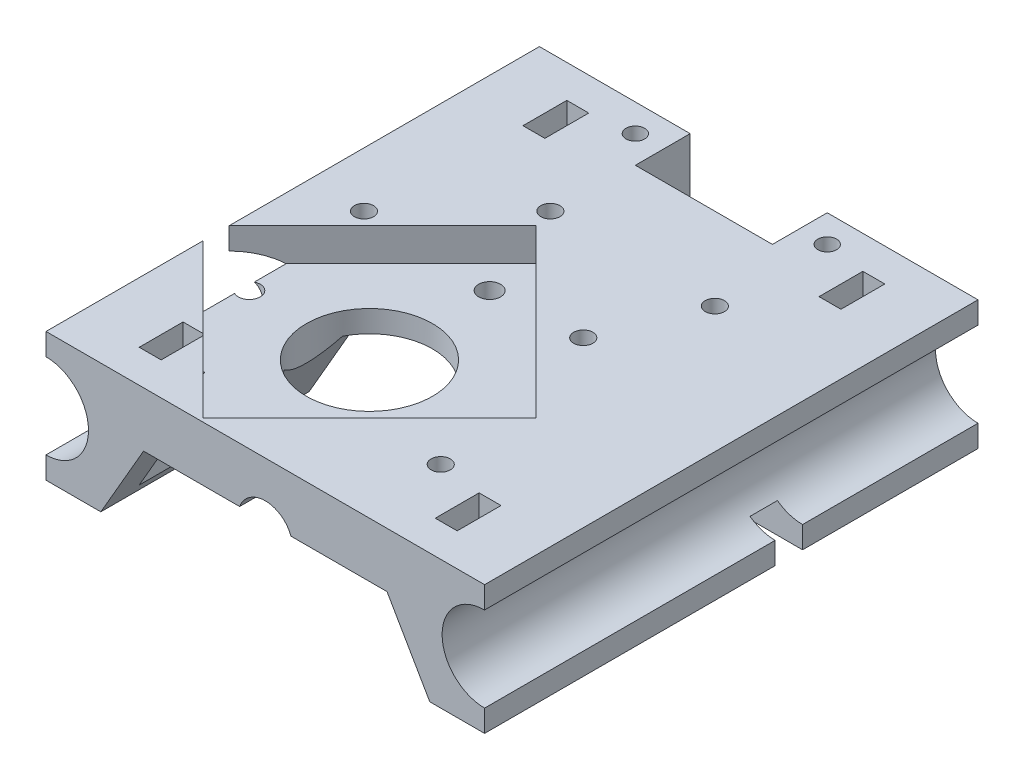
from build123d import *

# Parameters (mm, degrees)
RESSALTO_EXTRUS_O1_DEPTH   = 90
ESBO_O2_R                  = 5
CORTE_EXTRUS_O1_DEPTH      = 6
CORTE_EXTRUS_O2_DEPTH      = 101.031245119
CORTE_EXTRUS_O2_DEPTH_BACK = 101.031245119
ESBO_O3_R                  = 2
ESBO_O3_R_2                = 11.5
ESBO_O3_R_3                = 1.75
ESBO_O3_R_4                = 1.7
ESBO_O3_W                  = 25
ESBO_O3_H                  = 10
CORTE_EXTRUS_O4_START      = 8
ESBO_O4_W                  = 22.305447344
ESBO_O4_H                  = 5
ESBO_O4_W_2                = 48.791448981
CORTE_EXTRUS_O4_DEPTH      = 12
CORTE_EXTRUS_O7_REACH      = 103.253
ESBO_O6_R                  = 8
ESBO_O6_W                  = 20
ESBO_O6_H                  = 20
ESBO_O7_W                  = 4
ESBO_O7_H                  = 8
CORTE_EXTRUS_O8_DEPTH      = 102.253395156
ESBO_O11_R                 = 3.5
ESBO_O11_R_2               = 1.75
RESSALTO_EXTRUS_O3_DEPTH   = 12


with BuildPart() as part:
    # Esboço1 → Ressalto-extrusão1 (new body)
    with BuildSketch(Plane.XY):
        with BuildLine():
            Line((40, 0), (-40, 0))
            Line((-40, 0), (-40, -4))
            ThreePointArc((-40, -4), (-32.25, -11.75), (-40, -19.5))
            Line((-40, -19.5), (-40, -23.5))
            Line((-40, -23.5), (-30, -23.5))
            Line((-30, -23.5), (-22.205771366, -10))
            Line((-22.205771366, -10), (-4.683748499, -10))
            ThreePointArc((-4.683748499, -10), (0, -6.75), (4.683748499, -10))
            Line((4.683748499, -10), (22.205771366, -10))
            Line((22.205771366, -10), (30, -23.5))
            Line((30, -23.5), (40, -23.5))
            Line((40, -23.5), (40, -19.5))
            ThreePointArc((40, -19.5), (32.25, -11.75), (40, -4))
            Line((40, -4), (40, 0))
        make_face()
    extrude(amount=RESSALTO_EXTRUS_O1_DEPTH)

    # Esboço2 → Corte-extrusão1 (cut)
    with BuildSketch(Plane(origin=(0, 0, 0), x_dir=(1, 0, 0), z_dir=(0, 1, 0))):
        Polygon((-42.405591591, -59), (-12, -28.594408409), (18.405591591, -59), (-12, -89.405591591), align=None)
        with Locations(Location((-12, -59, 0), (0, 0, 270))):
            Circle(ESBO_O2_R, mode=Mode.SUBTRACT)
    extrude(amount=-CORTE_EXTRUS_O1_DEPTH, mode=Mode.SUBTRACT)

    # Esboço3 → Corte-extrusão2 (cut, two sides: drawn at the far end of the back side and taken through both)
    with BuildSketch(Plane(origin=(0, -6, 0), x_dir=(1, 0, 0), z_dir=(0, 1, 0)).offset(-CORTE_EXTRUS_O2_DEPTH_BACK)):
        with Locations(Location((-12, -37.079689783, 0), (0, 0, 180))):
            Circle(ESBO_O3_R)
        with Locations(Location((9.920310217, -59, 0), (0, 0, 180))):
            Circle(ESBO_O3_R)
        with Locations(Location((-12, -80.920310217, 0), (0, 0, 180))):
            Circle(ESBO_O3_R)
        with Locations(Location((-33.920310217, -59, 0), (0, 0, 180))):
            Circle(ESBO_O3_R)
        with Locations(Location((-12, -59, 0), (0, 0, 180))):
            Circle(ESBO_O3_R_2)
        with Locations(Location((-30, -42, 0), (0, 0, 180))):
            Circle(ESBO_O3_R_3)
        with Locations(Location((10, -42, 0), (0, 0, 180))):
            Circle(ESBO_O3_R_3)
        with Locations(Location((-17.5, -5, 0), (0, 0, 180))):
            Circle(ESBO_O3_R_4)
        with Locations(Location((17.5, -5, 0), (0, 0, 180))):
            Circle(ESBO_O3_R_4)
        with Locations(Location((17, -75, 0), (0, 0, 180))):
            Circle(ESBO_O3_R_3)
        with Locations(Location((-13, -25, 0), (0, 0, 180))):
            Circle(ESBO_O3_R_3)
        with Locations(Location((17, -25, 0), (0, 0, 180))):
            Circle(ESBO_O3_R_3)
        with Locations((0, -5)):
            Rectangle(ESBO_O3_W, ESBO_O3_H)
    extrude(amount=CORTE_EXTRUS_O2_DEPTH + CORTE_EXTRUS_O2_DEPTH_BACK, mode=Mode.SUBTRACT)

    # Esboço4 → Corte-extrusão4 (cut)
    with BuildSketch(Plane.XZ.offset(10).offset(CORTE_EXTRUS_O4_START)):
        with BuildLine():
            Line((-13.998411754, 37), (-22.205771366, 37))
            Line((-22.205771366, 37), (-22.205771366, 32))
            Line((-22.205771366, 32), (-4.683748499, 32))
            Line((-4.683748499, 32), (-4.683748499, 37))
            Line((-4.683748499, 37), (-10.001588246, 37))
            ThreePointArc((-10.001588246, 37), (-12, 35.079689783), (-13.998411754, 37))
        make_face()
        with Locations((-33.358495038, 34.5)):
            Rectangle(ESBO_O4_W, ESBO_O4_H)
        with Locations((19.711975992, 34.5)):
            Rectangle(ESBO_O4_W_2, ESBO_O4_H)
    extrude(amount=CORTE_EXTRUS_O4_DEPTH, mode=Mode.SUBTRACT)

    # Corte-extrusão7: up to this face of the body (flat: up to its plane)
    corte_extrus_o7_end = Plane(part.part.faces().sort_by_distance((-13.702636596, -10, 79.456396835))[0])
    # Esboço6 → Corte-extrusão7 (cut, up to the picked face)
    with BuildSketch(Plane.XZ.offset(23.5), mode=Mode.PRIVATE) as corte_extrus_o7_sk1:
        with Locations((17, 75)):
            Circle(ESBO_O6_R)
    corte_extrus_o7_tool1 = split(extrude(corte_extrus_o7_sk1.sketch, amount=-CORTE_EXTRUS_O7_REACH, mode=Mode.PRIVATE), bisect_by=corte_extrus_o7_end, keep=Keep.BOTH, mode=Mode.PRIVATE)
    # Esboço6 → Corte-extrusão7 (cut, up to the picked face)
    with BuildSketch(Plane.XZ.offset(23.5), mode=Mode.PRIVATE) as corte_extrus_o7_sk2:
        with Locations((17, 25)):
            Circle(ESBO_O6_R)
    corte_extrus_o7_tool2 = split(extrude(corte_extrus_o7_sk2.sketch, amount=-CORTE_EXTRUS_O7_REACH, mode=Mode.PRIVATE), bisect_by=corte_extrus_o7_end, keep=Keep.BOTH, mode=Mode.PRIVATE)
    # Esboço6 → Corte-extrusão7 (cut, up to the picked face)
    with BuildSketch(Plane.XZ.offset(23.5), mode=Mode.PRIVATE) as corte_extrus_o7_sk3:
        with Locations((-13, 25)):
            Circle(ESBO_O6_R)
    corte_extrus_o7_tool3 = split(extrude(corte_extrus_o7_sk3.sketch, amount=-CORTE_EXTRUS_O7_REACH, mode=Mode.PRIVATE), bisect_by=corte_extrus_o7_end, keep=Keep.BOTH, mode=Mode.PRIVATE)
    # Esboço6 → Corte-extrusão7 (cut, up to the picked face)
    with BuildSketch(Plane.XZ.offset(23.5), mode=Mode.PRIVATE) as corte_extrus_o7_sk4:
        with Locations((-30, 42)):
            Rectangle(ESBO_O6_W, ESBO_O6_H)
    corte_extrus_o7_tool4 = split(extrude(corte_extrus_o7_sk4.sketch, amount=-CORTE_EXTRUS_O7_REACH, mode=Mode.PRIVATE), bisect_by=corte_extrus_o7_end, keep=Keep.BOTH, mode=Mode.PRIVATE)
    add(corte_extrus_o7_tool1.solids().sort_by(Axis((17, -23.5, 75), (0, 1, 0)))[0], mode=Mode.SUBTRACT)
    add(corte_extrus_o7_tool2.solids().sort_by(Axis((17, -23.5, 25), (0, 1, 0)))[0], mode=Mode.SUBTRACT)
    add(corte_extrus_o7_tool3.solids().sort_by(Axis((-13, -23.5, 25), (0, 1, 0)))[0], mode=Mode.SUBTRACT)
    add(corte_extrus_o7_tool4.solids().sort_by(Axis((-30, -23.5, 42), (0, 1, 0)))[0], mode=Mode.SUBTRACT)

    # Esboço7 → Corte-extrusão8 (cut, through all)
    with BuildSketch(Plane(origin=(0, 0, 0), x_dir=(1, 0, 0), z_dir=(0, 1, 0))):
        with Locations((27.000875928, -80)):
            Rectangle(ESBO_O7_W, ESBO_O7_H)
        with Locations((27.000875928, -10)):
            Rectangle(ESBO_O7_W, ESBO_O7_H)
        with Locations((-27.000875928, -10)):
            Rectangle(ESBO_O7_W, ESBO_O7_H)
        with Locations((-27.000875928, -80)):
            Rectangle(ESBO_O7_W, ESBO_O7_H)
    extrude(amount=-CORTE_EXTRUS_O8_DEPTH, mode=Mode.SUBTRACT)

    # Esboço11 → Ressalto-extrusão3 (add)
    # profile 1 of 3: a face of its own
    with BuildSketch(Plane.XZ.offset(10)):
        with Locations(Location((-13, 25, 0), (0, 0, 180))):
            Circle(ESBO_O11_R)
        with Locations(Location((-13, 25, 0), (0, 0, 180))):
            Circle(ESBO_O11_R_2, mode=Mode.SUBTRACT)
    # profile 2 of 3: a face of its own
    with BuildSketch(Plane.XZ.offset(10)):
        with Locations(Location((17, 25, 0), (0, 0, 180))):
            Circle(ESBO_O11_R)
        with Locations(Location((17, 25, 0), (0, 0, 180))):
            Circle(ESBO_O11_R_2, mode=Mode.SUBTRACT)
    # profile 3 of 3: a face of its own
    with BuildSketch(Plane.XZ.offset(10)):
        with Locations(Location((17, 75, 0), (0, 0, 180))):
            Circle(ESBO_O11_R)
        with Locations(Location((17, 75, 0), (0, 0, 180))):
            Circle(ESBO_O11_R_2, mode=Mode.SUBTRACT)
    extrude(amount=RESSALTO_EXTRUS_O3_DEPTH)


solid = part.part
